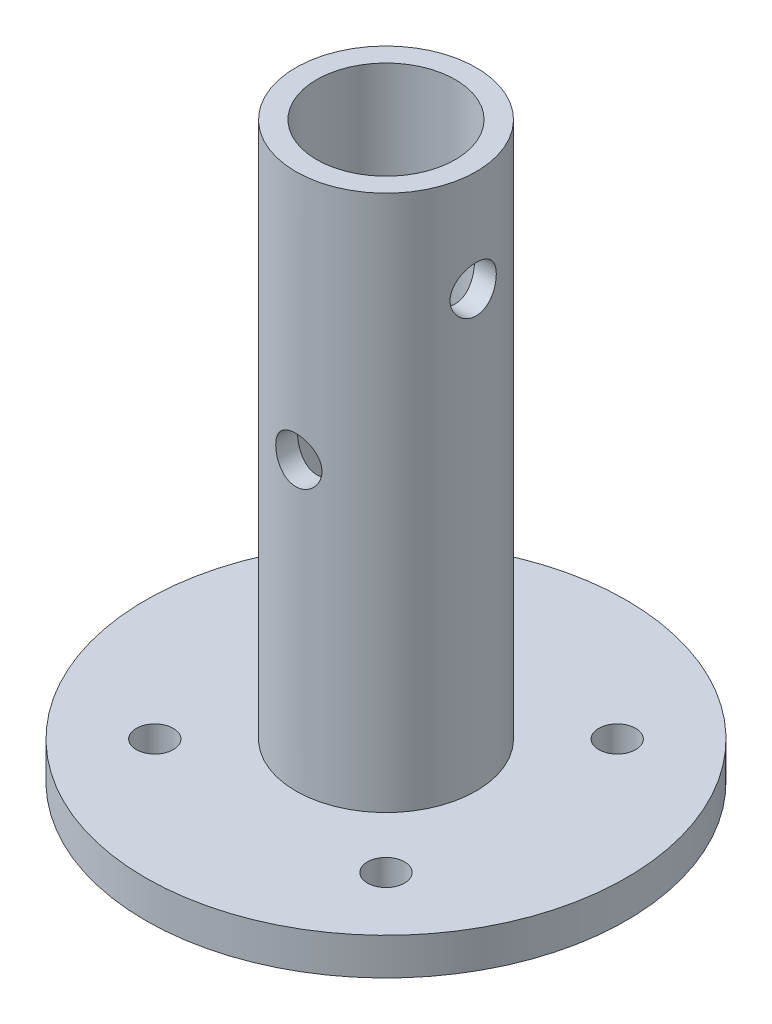
from build123d import *

# Parameters (mm, degrees)
SKETCH1_R               = 26
SKETCH1_R_2             = 2
SKETCH1_R_3             = 7.5
BOSS_EXTRUDE1_DEPTH     = 4
SKETCH3_R               = 9.75
SKETCH3_R_2             = 7.5
BOSS_EXTRUDE2_DEPTH     = 58
CUT_EXTRUDE1_DEPTH      = 73.083285164
CUT_EXTRUDE1_DEPTH_BACK = 73.083285164
SKETCH5_R               = 2.5
CUT_EXTRUDE2_DEPTH      = 73.08328525
CUT_EXTRUDE2_DEPTH_BACK = 73.08328525
SKETCH6_R               = 2.5


with BuildPart() as part:
    # Sketch1 → Boss-Extrude1 (new body)
    with BuildSketch(Plane(origin=(0, 0, 0), x_dir=(1, 0, 0), z_dir=(0, 1, 0))):
        with Locations(Location((0, 0, 0), (0, 0, 270))):
            Circle(SKETCH1_R)
        with Locations(Location((-12.5, 12.5, 0), (0, 0, 270))):
            Circle(SKETCH1_R_2, mode=Mode.SUBTRACT)
        with Locations(Location((-12.5, -12.5, 0), (0, 0, 270))):
            Circle(SKETCH1_R_2, mode=Mode.SUBTRACT)
        with Locations(Location((12.5, 12.5, 0), (0, 0, 270))):
            Circle(SKETCH1_R_2, mode=Mode.SUBTRACT)
        with Locations(Location((12.5, -12.5, 0), (0, 0, 270))):
            Circle(SKETCH1_R_2, mode=Mode.SUBTRACT)
        with Locations(Location((0, 0, 0), (0, 0, 270))):
            Circle(SKETCH1_R_3, mode=Mode.SUBTRACT)
    extrude(amount=BOSS_EXTRUDE1_DEPTH)

    # Sketch3 → Boss-Extrude2 (add)
    with BuildSketch(Plane(origin=(0, 4, 0), x_dir=(1, 0, 0), z_dir=(0, 1, 0))):
        with Locations(Location((0, 0, 0), (0, 0, 90))):
            Circle(SKETCH3_R)
        with Locations(Location((0, 0, 0), (0, 0, 270))):
            Circle(SKETCH3_R_2, mode=Mode.SUBTRACT)
    extrude(amount=BOSS_EXTRUDE2_DEPTH)

    # Sketch5 → Cut-Extrude1 (cut, two sides: drawn at the far end of the back side and taken through both)
    with BuildSketch(Plane.XY.offset(-CUT_EXTRUDE1_DEPTH_BACK)):
        with Locations((0, 35)):
            Circle(SKETCH5_R)
    extrude(amount=CUT_EXTRUDE1_DEPTH + CUT_EXTRUDE1_DEPTH_BACK, mode=Mode.SUBTRACT)

    # Sketch6 → Cut-Extrude2 (cut, two sides: drawn at the far end of the back side and taken through both)
    with BuildSketch(Plane(origin=(0, 0, 0), x_dir=(0, 0, -1), z_dir=(1, 0, 0)).offset(-CUT_EXTRUDE2_DEPTH_BACK)):
        with Locations((0, 51)):
            Circle(SKETCH6_R)
    extrude(amount=CUT_EXTRUDE2_DEPTH + CUT_EXTRUDE2_DEPTH_BACK, mode=Mode.SUBTRACT)


solid = part.part
